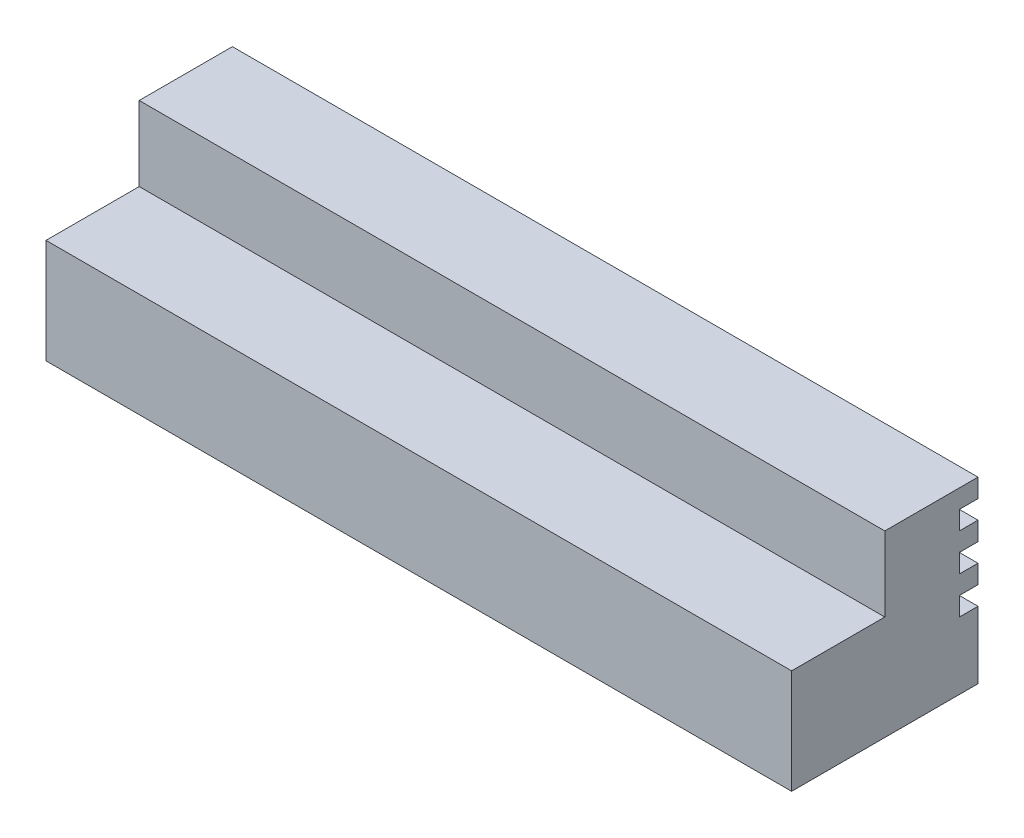
from build123d import *

# Parameters (mm, degrees)
SKETCH1_W               = 200
SKETCH1_H               = 50
EXTRUDE1_DEPTH          = 48
ESQUISSE1_W             = 25
ESQUISSE1_H             = 20
ESQUISSE1_W_2           = 5
ESQUISSE1_H_2           = 5
ENL_V_MAT_EXTRU_1_DEPTH = 212.669553786


with BuildPart() as part:
    # Sketch1 → Extrude1 (new body)
    with BuildSketch(Plane(origin=(0, 0, 0), x_dir=(1, 0, 0), z_dir=(0, 1, 0))):
        with Locations((100, 25)):
            Rectangle(SKETCH1_W, SKETCH1_H)
    extrude(amount=EXTRUDE1_DEPTH)

    # Esquisse1 → Enlèv. mat.-Extru.1 (cut, through all)
    with BuildSketch(Plane(origin=(200, 0, 0), x_dir=(0, 0, -1), z_dir=(1, 0, 0))):
        with Locations((12.5, 38)):
            Rectangle(ESQUISSE1_W, ESQUISSE1_H)
        with Locations((47.5, 40.5)):
            Rectangle(ESQUISSE1_W_2, ESQUISSE1_H_2)
        with Locations((47.5, 30.5)):
            Rectangle(ESQUISSE1_W_2, ESQUISSE1_H_2)
        with Locations((47.5, 20.5)):
            Rectangle(ESQUISSE1_W_2, ESQUISSE1_H_2)
    extrude(amount=-ENL_V_MAT_EXTRU_1_DEPTH, mode=Mode.SUBTRACT)


solid = part.part
